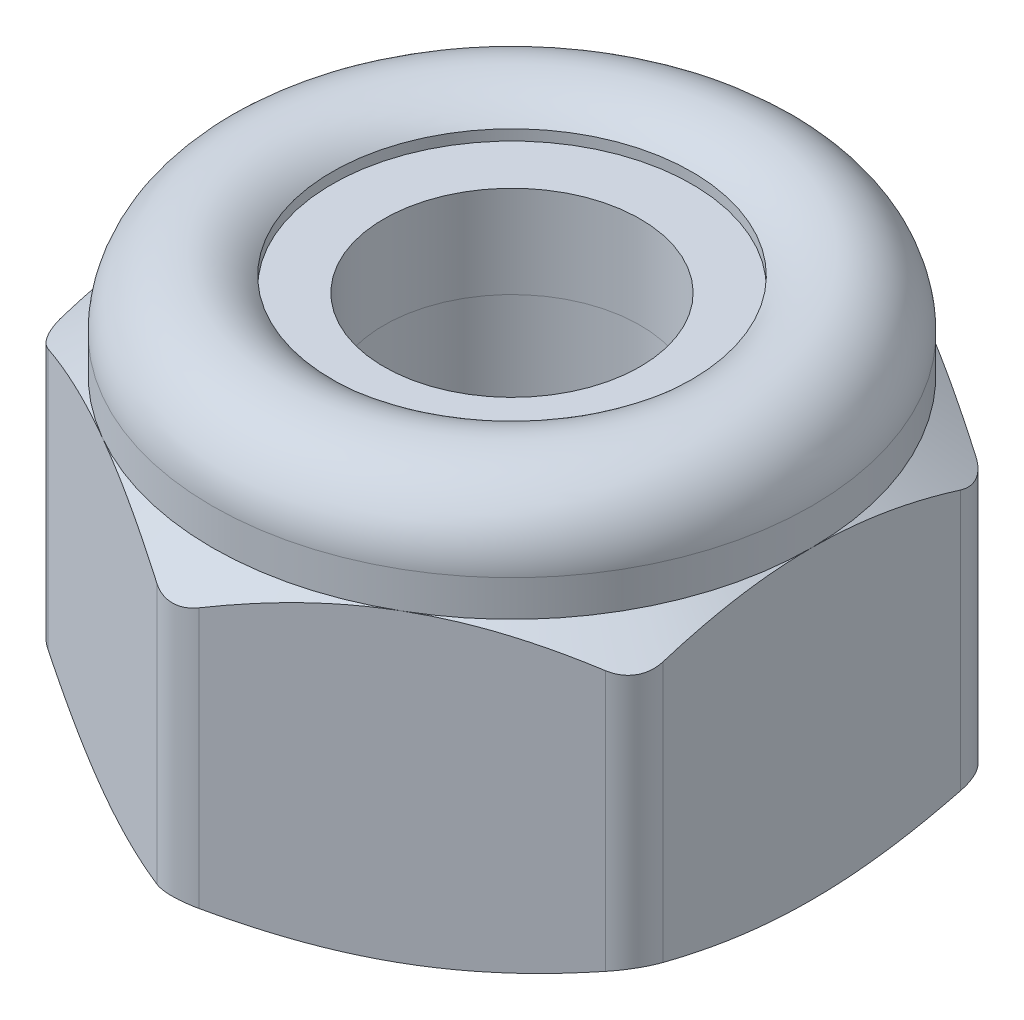
from build123d import *

# Parameters (mm, degrees)
BOSS_EXTRUDE1_DEPTH      = 1.95
BOSS_EXTRUDE1_DEPTH_BACK = 1.95
SKETCH2_R                = 1.175240474
FILLET1_R                = 0.385
SKETCH12_W               = 0.455634919
SKETCH12_H               = 0.883769837
SKETCH4_W                = 0.930394445
SKETCH4_H                = 0.844769837


with BuildPart() as part:
    # Sketch2 → Boss-Extrude1 (new, two sides: drawn at the far end of the back side and taken through both)
    with BuildSketch(Plane(origin=(0, 0, 0), x_dir=(1, 0, 0), z_dir=(0, 1, 0)).offset(-BOSS_EXTRUDE1_DEPTH_BACK)):
        Polygon((0, 3.175426481), (-2.75, 1.58771324), (-2.75, -1.58771324), (0, -3.175426481), (2.75, -1.58771324), (2.75, 1.58771324), align=None)
        with Locations(Location((0, 0, 0), (0, 0, 270))):
            Circle(SKETCH2_R, mode=Mode.SUBTRACT)
    extrude(amount=BOSS_EXTRUDE1_DEPTH + BOSS_EXTRUDE1_DEPTH_BACK)

    # Fillet1
    fillet1_edges = [part.edges().sort_by_distance(p)[0] for p in [
        (2.75, 0, -1.58771324),
        (2.75, 0, 1.58771324),
        (0, 0, 3.175426481),
        (-2.75, 0, 1.58771324),
        (-2.75, 0, -1.58771324),
        (0, 0, -3.175426481),
    ]]
    fillet(fillet1_edges, radius=FILLET1_R)

    # Sketch3 → Cut-Revolve2 (revolve, cut)
    with BuildSketch(Plane(origin=(0, 0, 0), x_dir=(0, 0, -1), z_dir=(1, 0, 0)), mode=Mode.PRIVATE) as cut_revolve2_sk:
        with BuildLine():
            Line((3.175426481, 0.975), (3.175426481, 2.95))
            Line((3.175426481, 2.95), (1.175240474, 2.95))
            Line((1.175240474, 2.95), (1.175240474, 0.78))
            Line((1.175240474, 0.78), (1.65, 0.78))
            Line((1.65, 0.78), (1.65, 1.761269837))
            ThreePointArc((1.65, 1.761269837), (2.35222276, 1.900950629), (2.75, 1.305634919))
            Line((2.75, 1.305634919), (2.75, 0.975))
            Line((2.75, 0.975), (3.175426481, 0.677113171))
            Line((3.175426481, 0.677113171), (3.175426481, 0.975))
        make_face()
        Polygon((2.53, -1.95), (3.175426481, -1.577362848), (3.175426481, -1.95), align=None)
        Polygon((1.175240474, -1.95), (1.175240474, -1.65), (1.475240474, -1.95), align=None)
    revolve(cut_revolve2_sk.sketch.rotate(Axis((0, -1.95, 0), (0, 1, 0)), 270), axis=Axis((0, -1.95, 0), (0, 1, 0)), mode=Mode.SUBTRACT)

    # Sketch12 → Cut-Revolve3 (revolve, cut)
    with BuildSketch(Plane(origin=(0, 0, 0), x_dir=(0, 0, -1), z_dir=(1, 0, 0)), mode=Mode.PRIVATE) as cut_revolve3_sk:
        with Locations((1.87781746, 1.221884919)):
            Rectangle(SKETCH12_W, SKETCH12_H)
    revolve(cut_revolve3_sk.sketch.rotate(Axis((0, 1.95, 0), (0, -1, 0)), 90), axis=Axis((0, 1.95, 0), (0, -1, 0)), mode=Mode.SUBTRACT)


with BuildPart() as body_2:
    # Sketch4 → Revolve1 (revolve)
    with BuildSketch(Plane(origin=(0, 0, 0), x_dir=(0, 0, -1), z_dir=(1, 0, 0)), mode=Mode.PRIVATE) as revolve1_sk:
        with Locations((1.640437697, 1.202384918)):
            Rectangle(SKETCH4_W, SKETCH4_H)
    revolve(revolve1_sk.sketch.rotate(Axis((0, -1.95, 0), (0, 1, 0)), 270), axis=Axis((0, -1.95, 0), (0, 1, 0)))


solid = Compound([part.part, body_2.part])
